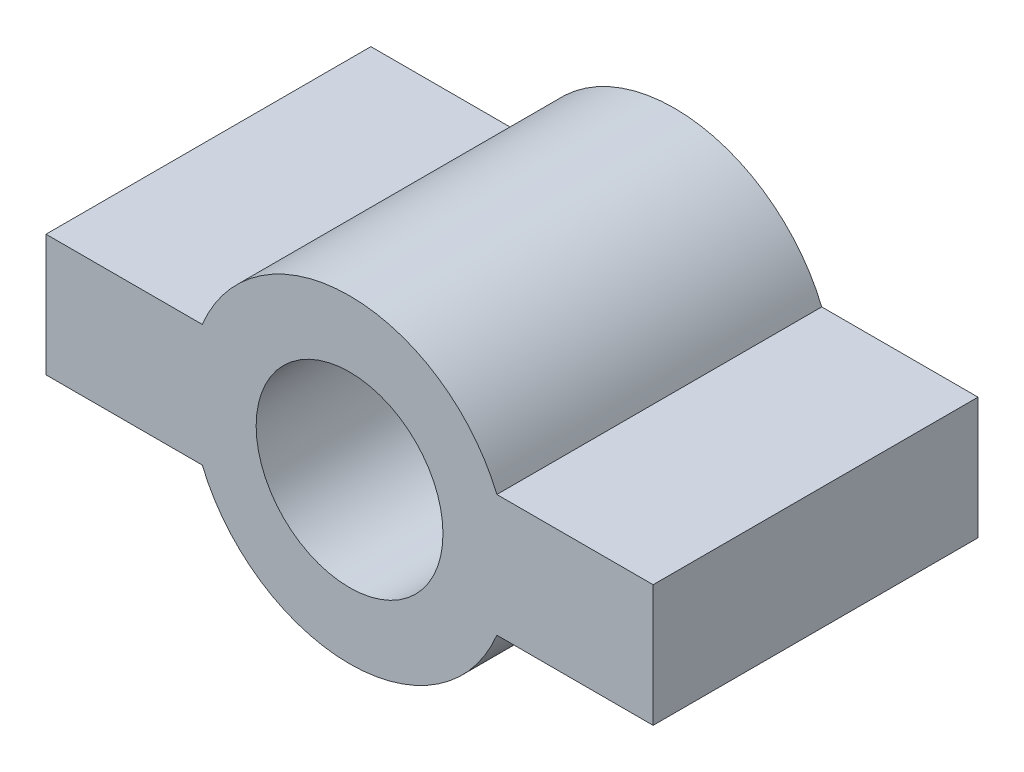
from build123d import *

# Parameters (mm, degrees)
CROQUIS1_R              = 2.3
SALIENTE_EXTRUIR1_DEPTH = 8


with BuildPart() as part:
    # Croquis1 → Saliente-Extruir1 (new body)
    with BuildSketch(Plane.XY):
        with BuildLine():
            Line((3.627068375, 1.5), (7.475, 1.5))
            Line((7.475, 1.5), (7.475, -1.5))
            Line((7.475, -1.5), (3.627068375, -1.5))
            ThreePointArc((3.627068375, -1.5), (0, -3.925), (-3.627068375, -1.5))
            Line((-3.627068375, -1.5), (-7.475, -1.5))
            Line((-7.475, -1.5), (-7.475, 1.5))
            Line((-7.475, 1.5), (-3.627068375, 1.5))
            ThreePointArc((-3.627068375, 1.5), (0, 3.925), (3.627068375, 1.5))
        make_face()
        Circle(CROQUIS1_R, mode=Mode.SUBTRACT)
    extrude(amount=-SALIENTE_EXTRUIR1_DEPTH)


solid = part.part
